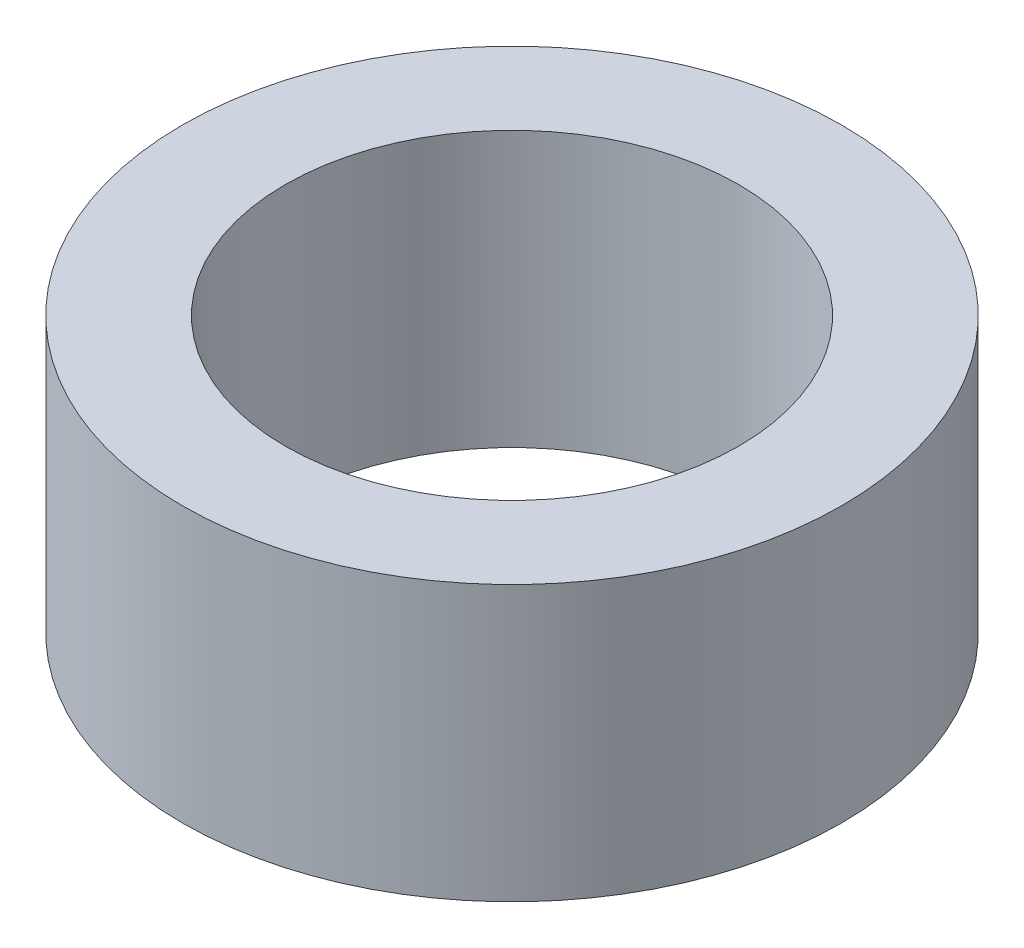
from build123d import *

# Parameters (mm, degrees)
SKETCH1_R           = 6
SKETCH1_R_2         = 4.125
BOSS_EXTRUDE1_DEPTH = 5


with BuildPart() as part:
    # Sketch1 → Boss-Extrude1 (new body)
    with BuildSketch(Plane(origin=(0, 0, 0), x_dir=(1, 0, 0), z_dir=(0, 1, 0))):
        Circle(SKETCH1_R)
        Circle(SKETCH1_R_2, mode=Mode.SUBTRACT)
    extrude(amount=BOSS_EXTRUDE1_DEPTH)


solid = part.part
